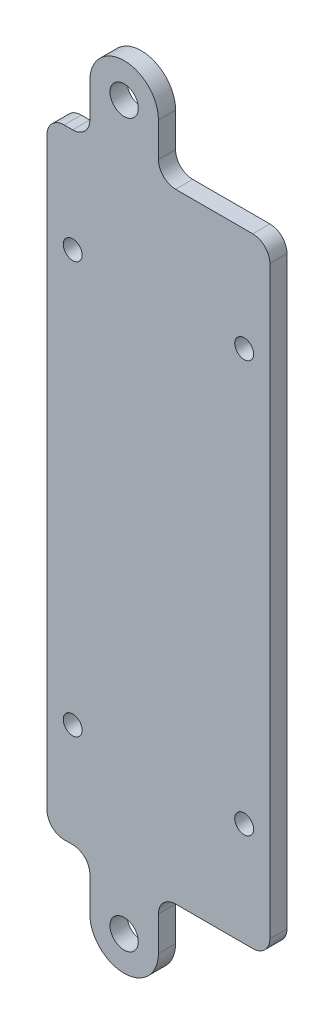
from build123d import *

# Parameters (mm, degrees)
SKETCH_1_W      = 26
SKETCH_1_H      = 72.2
SKETCH_1_R      = 1.1
EXTRUDE_1_DEPTH = 2
SKETCH_2_R      = 1.65
EXTRUDE_2_DEPTH = 2
FILLET_1_R      = 2


with BuildPart() as part:
    # 草图1 → 凸台-拉伸1 (new body)
    with BuildSketch(Plane.XY):
        Rectangle(SKETCH_1_W, SKETCH_1_H)
        with Locations((-10, 24)):
            Circle(SKETCH_1_R, mode=Mode.SUBTRACT)
        with Locations((10, 24)):
            Circle(SKETCH_1_R, mode=Mode.SUBTRACT)
        with Locations((-10, -24)):
            Circle(SKETCH_1_R, mode=Mode.SUBTRACT)
        with Locations((10, -24)):
            Circle(SKETCH_1_R, mode=Mode.SUBTRACT)
    extrude(amount=EXTRUDE_1_DEPTH)

    # 草图2 → 凸台-拉伸2 (add)
    # profile 1 of 2: a face of its own
    with BuildSketch(Plane.XY.offset(2)):
        with BuildLine():
            Line((-8, 42.1), (-8, 36.1))
            Line((-8, 36.1), (0, 36.1))
            Line((0, 36.1), (0, 42.1))
            ThreePointArc((0, 42.1), (-4, 46.1), (-8, 42.1))
        make_face()
        with Locations((-4, 42.1)):
            Circle(SKETCH_2_R, mode=Mode.SUBTRACT)
    # profile 2 of 2: a face of its own
    with BuildSketch(Plane.XY.offset(2)):
        with BuildLine():
            Line((-8, -42.1), (-8, -36.1))
            Line((-8, -36.1), (0, -36.1))
            Line((0, -36.1), (0, -42.1))
            ThreePointArc((0, -42.1), (-4, -46.1), (-8, -42.1))
        make_face()
        with Locations((-4, -42.1)):
            Circle(SKETCH_2_R, mode=Mode.SUBTRACT)
    extrude(amount=-EXTRUDE_2_DEPTH)

    # 圆角1
    fillet_1_edges = [part.edges().sort_by_distance(p)[0] for p in [
        (-8, 36.1, 1),
        (0, 36.1, 1),
        (0, -36.1, 1),
        (-8, -36.1, 1),
        (-13, 36.1, 1),
        (13, 36.1, 1),
        (13, -36.1, 1),
        (-13, -36.1, 1),
    ]]
    fillet(fillet_1_edges, radius=FILLET_1_R)


solid = part.part
